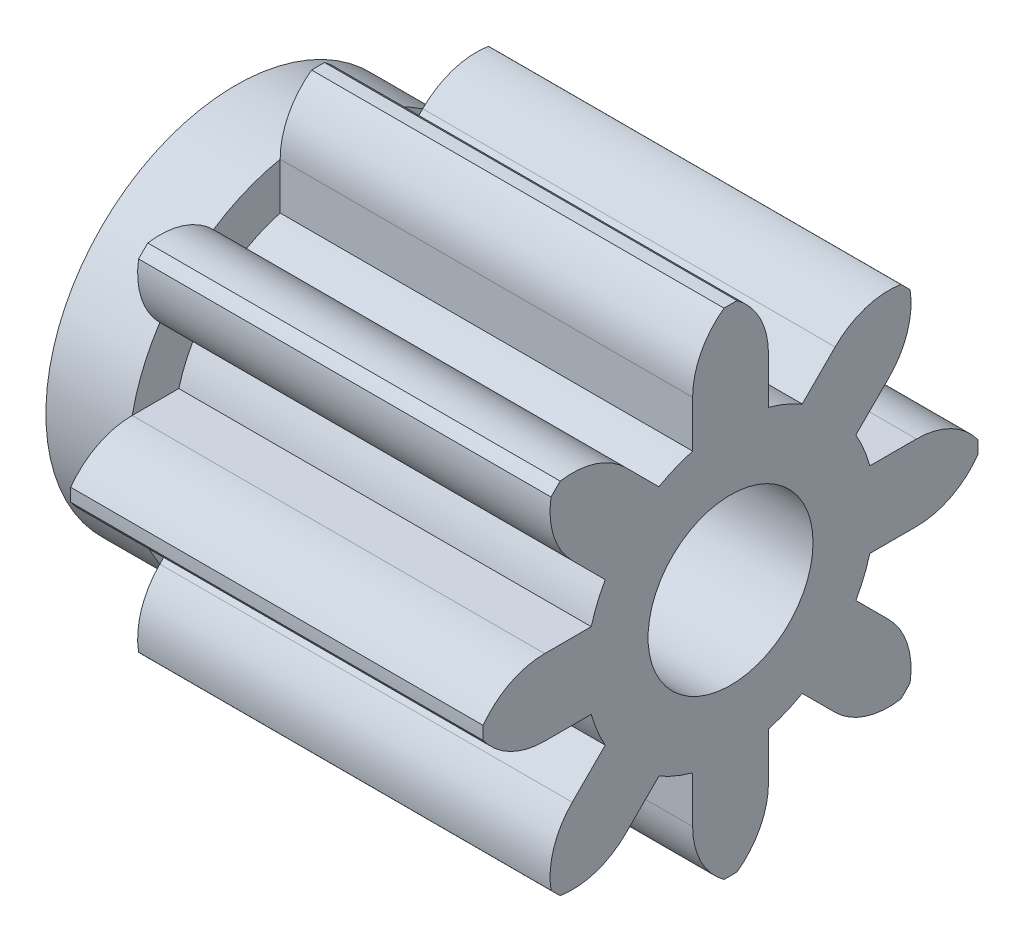
from build123d import *

# Parameters (mm, degrees)
SKETCH1_R           = 2.3
BOSS_EXTRUDE1_DEPTH = 1
SKETCH2_R           = 1.75
SKETCH2_R_2         = 1
BOSS_EXTRUDE2_DEPTH = 5
BOSS_EXTRUDE3_DEPTH = 5
CIRPATTERN1_COUNT   = 8


with BuildPart() as part:
    # Sketch1 → Boss-Extrude1 (new body)
    with BuildSketch(Plane(origin=(0, 0, 0), x_dir=(0, 0, -1), z_dir=(1, 0, 0))):
        Circle(SKETCH1_R)
    extrude(amount=BOSS_EXTRUDE1_DEPTH)

    # Sketch2 → Boss-Extrude2 (add)
    with BuildSketch(Plane(origin=(1, 0, 0), x_dir=(0, 0, -1), z_dir=(1, 0, 0))):
        Circle(SKETCH2_R)
        Circle(SKETCH2_R_2, mode=Mode.SUBTRACT)
    extrude(amount=BOSS_EXTRUDE2_DEPTH)


with BuildPart() as body_2:
    # Sketch3 → Boss-Extrude3 (new body)
    with BuildSketch(Plane(origin=(1, 0, 0), x_dir=(0, 0, -1), z_dir=(1, 0, 0))):
        with BuildLine():
            ThreePointArc((-0.45982072, 1.68850967), (0, 1.75), (0.45982072, 1.68850967))
            Line((0.45982072, 1.68850967), (0.45982072, 2.253567151))
            ThreePointArc((0.45982072, 2.253567151), (0.359046611, 2.672132166), (0.078809895, 2.998964655))
            ThreePointArc((0.078809895, 2.998964655), (0, 3), (-0.078809895, 2.998964655))
            ThreePointArc((-0.078809895, 2.998964655), (-0.359046611, 2.672132166), (-0.45982072, 2.253567151))
            Line((-0.45982072, 2.253567151), (-0.45982072, 1.68850967))
        make_face()
    extrude(amount=BOSS_EXTRUDE3_DEPTH)


with BuildPart() as cirpattern1_1:
    # CirPattern1: pattern copy
    add(body_2.part.rotate(Axis((0, 0, 0), (1, 0, 0)), 1 * 360 / CIRPATTERN1_COUNT))


with BuildPart() as cirpattern1_2:
    # CirPattern1: pattern copy
    add(body_2.part.rotate(Axis((0, 0, 0), (1, 0, 0)), 2 * 360 / CIRPATTERN1_COUNT))


with BuildPart() as cirpattern1_3:
    # CirPattern1: pattern copy
    add(body_2.part.rotate(Axis((0, 0, 0), (1, 0, 0)), 3 * 360 / CIRPATTERN1_COUNT))


with BuildPart() as cirpattern1_4:
    # CirPattern1: pattern copy
    add(body_2.part.rotate(Axis((0, 0, 0), (1, 0, 0)), 4 * 360 / CIRPATTERN1_COUNT))


with BuildPart() as cirpattern1_5:
    # CirPattern1: pattern copy
    add(body_2.part.rotate(Axis((0, 0, 0), (1, 0, 0)), 5 * 360 / CIRPATTERN1_COUNT))


with BuildPart() as cirpattern1_6:
    # CirPattern1: pattern copy
    add(body_2.part.rotate(Axis((0, 0, 0), (1, 0, 0)), 6 * 360 / CIRPATTERN1_COUNT))


with BuildPart() as cirpattern1_7:
    # CirPattern1: pattern copy
    add(body_2.part.rotate(Axis((0, 0, 0), (1, 0, 0)), 7 * 360 / CIRPATTERN1_COUNT))


with BuildPart() as body_2_1:
    add(body_2.part)

    # Combine1: union CirPattern1_7, CirPattern1_6, CirPattern1_4, CirPattern1_3, part, CirPattern1_1, CirPattern1_2, CirPattern1_5
    add(cirpattern1_7.part)
    add(cirpattern1_6.part)
    add(cirpattern1_4.part)
    add(cirpattern1_3.part)
    add(part.part)
    add(cirpattern1_1.part)
    add(cirpattern1_2.part)
    add(cirpattern1_5.part)


solid = body_2_1.part
